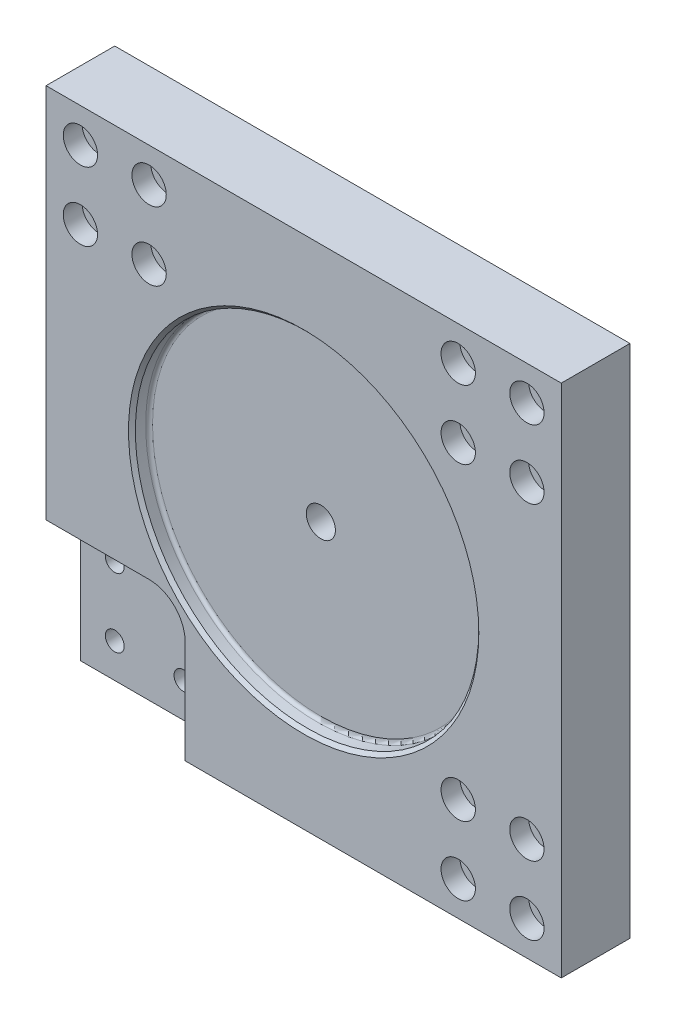
from build123d import *

# Parameters (mm, degrees)
SKETCH1_W                                           = 150
SKETCH1_H                                           = 150
BOSS_EXTRUDE1_DEPTH                                 = 20
M10_TAPPED_HOLE1_D                                  = 8.5
CBORE_FOR_M5_HEX_SOCKET_HEAD_CAP_SCREW1_D           = 5.5
CBORE_FOR_M5_HEX_SOCKET_HEAD_CAP_SCREW1_CBORE_D     = 10
CBORE_FOR_M5_HEX_SOCKET_HEAD_CAP_SCREW1_CBORE_DEPTH = 5.5
F_5_5_5_5_DIAMETER_HOLE1_D                          = 5.5
SKETCH6_R                                           = 50
CUT_EXTRUDE1_DEPTH                                  = 5
FILLET1_R                                           = 1
CHAMFER2_SIZE                                       = 1
CUT_EXTRUDE2_DEPTH                                  = 10


with BuildPart() as part:
    # Sketch1 → Boss-Extrude1 (new body)
    with BuildSketch(Plane.XY):
        Rectangle(SKETCH1_W, SKETCH1_H)
    extrude(amount=BOSS_EXTRUDE1_DEPTH)

    # M10 Tapped Hole1 (through all)
    with Locations(Plane.XY.offset(20)):
        with Locations((0, 0)):
            Hole(M10_TAPPED_HOLE1_D / 2)

    # CBORE for M5 Hex Socket Head Cap Screw1 (through all)
    with Locations(Plane.XY.offset(20)):
        with Locations((-65, 65), (-45, 65), (-65, 45), (65, -45), (65, -65), (45, -65), (45, 65), (65, 65), (65, 45), (45, -45), (-45, 45), (45, 45)):
            CounterBoreHole(CBORE_FOR_M5_HEX_SOCKET_HEAD_CAP_SCREW1_D / 2, CBORE_FOR_M5_HEX_SOCKET_HEAD_CAP_SCREW1_CBORE_D / 2, CBORE_FOR_M5_HEX_SOCKET_HEAD_CAP_SCREW1_CBORE_DEPTH)

    # Ø5.5 (5.5) Diameter Hole1 (through all)
    with Locations(Plane.XY.offset(20)):
        with Locations((-65, -45), (-45, -45), (-45, -65), (-65, -65)):
            Hole(F_5_5_5_5_DIAMETER_HOLE1_D / 2)

    # Sketch6 → Cut-Extrude1 (cut)
    with BuildSketch(Plane.XY.offset(20)):
        Circle(SKETCH6_R)
    extrude(amount=-CUT_EXTRUDE1_DEPTH, mode=Mode.SUBTRACT)

    # Fillet1
    fillet1_edges = [part.edges().sort_by_distance(p)[0] for p in [
        (-50, 0, 15),
    ]]
    fillet(fillet1_edges, radius=FILLET1_R)

    # Chamfer2
    chamfer2_edges = [part.edges().sort_by_distance(p)[0] for p in [
        (-50, 0, 20),
    ]]
    chamfer(chamfer2_edges, length=CHAMFER2_SIZE)

    # Sketch7 → Cut-Extrude2 (cut)
    with BuildSketch(Plane.XY.offset(20)):
        with BuildLine():
            Line((-75, -75), (-34.5, -75))
            Line((-34.5, -75), (-34.5, -45))
            ThreePointArc((-34.5, -45), (-37.575378798, -37.575378798), (-45, -34.5))
            Line((-45, -34.5), (-75, -34.5))
            Line((-75, -34.5), (-75, -75))
        make_face()
    extrude(amount=-CUT_EXTRUDE2_DEPTH, mode=Mode.SUBTRACT)


solid = part.part
